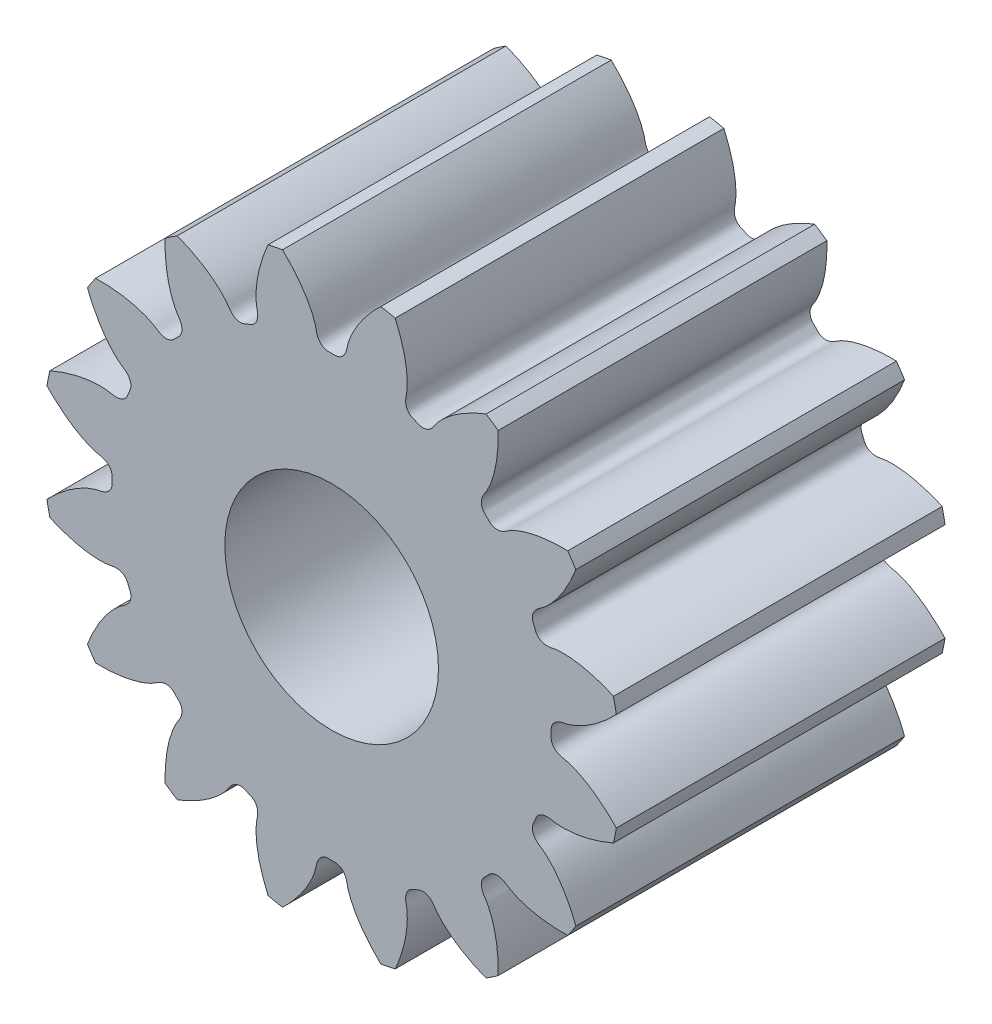
from build123d import *

# Parameters (mm, degrees)
SKETCHREVOLVESPURASSEMBLYNEW1PINION_W       = 10
SKETCHREVOLVESPURASSEMBLYNEW1PINION_H       = 8.7890625
TOOTHEXTRUDECUTSPURASSEMBLYNEW1PINION_START = -8
TOOTHEXTRUDECUTSPURASSEMBLYNEW1PINION_DEPTH = 12
PATTERNSPURASSEMBLYNEW1PINION_COUNT         = 16
SKETCH_1_R                                  = 3.25
CUT_EXTRUDE_1_DEPTH                         = 16.812131127


with BuildPart() as part:
    # SketchRevolveSpurAssemblyNew1Pinion → SpurAssemblyNew1Pinion (revolve)
    with BuildSketch(Plane(origin=(0, 0, 0), x_dir=(0, 0, -1), z_dir=(1, 0, 0))):
        with Locations((1, 4.39453125)):
            Rectangle(SKETCHREVOLVESPURASSEMBLYNEW1PINION_W, SKETCHREVOLVESPURASSEMBLYNEW1PINION_H)
    revolve(axis=Axis((0, 0, 0), (0, 0, -1)))

    # SketchToothSpurAssemblyNew1Pinion → ToothExtrudeCutSpurAssemblyNew1Pinion (cut)
    with BuildSketch(Plane.XY.offset(TOOTHEXTRUDECUTSPURASSEMBLYNEW1PINION_START)):
        with BuildLine():
            ThreePointArc((8.716029229, 1.554211503), (8.853515625, 0), (8.716029229, -1.554211503))
            add(Edge.make_bspline(
                [(8.716029229, -1.554211503), (8.62862713, -1.459312517), (8.49597106, -1.325274969), (8.314106298, -1.161849014), (8.18489776, -1.054323465), (8.059772215, -0.957996086), (7.9393825, -0.872392365), (7.82435095, -0.797004542), (7.71526784, -0.731293527), (7.612689882, -0.674690752), (7.517138975, -0.626599252), (7.429100479, -0.586397842), (7.349023414, -0.553435542), (7.277314902, -0.527057087), (7.214352885, -0.506532288), (7.160443959, -0.491276196), (7.097952634, -0.475750728), (7.046337113, -0.467920657), (7.004280637, -0.45783036), (6.985712313, -0.452872019), (6.967326671, -0.447394665), (6.949080273, -0.441357303), (6.930926481, -0.434695757), (6.912813897, -0.427331849), (6.894687768, -0.419165828), (6.876491766, -0.410072132), (6.858171606, -0.399892969), (6.839681201, -0.388431378), (6.82099277, -0.375443904), (6.802112664, -0.360634431), (6.783104949, -0.343651932), (6.764124314, -0.32409723), (6.745458017, -0.301546699), (6.727570244, -0.275603076), (6.711137767, -0.245982977), (6.69703376, -0.212637772), (6.686295044, -0.175893357), (6.680036417, -0.13805875), (6.677926166, -0.079083938), (6.68098156, 0), (6.677926166, 0.079083938), (6.680036417, 0.13805875), (6.686295044, 0.175893357), (6.69703376, 0.212637772), (6.711137767, 0.245982977), (6.727570244, 0.275603076), (6.745458017, 0.301546699), (6.764124314, 0.32409723), (6.783104949, 0.343651932), (6.802112664, 0.360634431), (6.82099277, 0.375443904), (6.839681201, 0.388431378), (6.858171606, 0.399892969), (6.876491766, 0.410072132), (6.894687768, 0.419165828), (6.912813897, 0.427331849), (6.930926481, 0.434695757), (6.949080273, 0.441357303), (6.967326671, 0.447394665), (6.985712313, 0.452872019), (7.004280637, 0.45783036), (7.046337113, 0.467920657), (7.097952634, 0.475750728), (7.160443959, 0.491276196), (7.214352885, 0.506532288), (7.277314902, 0.527057087), (7.349023414, 0.553435542), (7.429100479, 0.586397842), (7.517138975, 0.626599252), (7.612689882, 0.674690752), (7.71526784, 0.731293527), (7.82435095, 0.797004542), (7.9393825, 0.872392365), (8.059772215, 0.957996086), (8.18489776, 1.054323465), (8.314106298, 1.161849014), (8.49597106, 1.325274969), (8.62862713, 1.459312517), (8.716029229, 1.554211503)],
                knots=[0, 0, 0, 0, 0.071940146, 0.105070476, 0.136307645, 0.165651652, 0.193102497, 0.218660181, 0.242324703, 0.264096063, 0.283974262, 0.301959299, 0.318051175, 0.332249889, 0.344555442, 0.354967833, 0.363487062, 0.380444448, 0.384031118, 0.387599323, 0.39116026, 0.394726966, 0.398314667, 0.401941182, 0.405627388, 0.409397748, 0.413280862, 0.417309997, 0.421523496, 0.425964841, 0.430682071, 0.43572602, 0.44114668, 0.446986911, 0.453273001, 0.460002642, 0.467132884, 0.474573007, 0.481318675, 0.5, 0.518681325, 0.525426993, 0.532867116, 0.539997358, 0.546726999, 0.553013089, 0.55885332, 0.56427398, 0.569317929, 0.574035159, 0.578476504, 0.582690003, 0.586719138, 0.590602252, 0.594372612, 0.598058818, 0.601685333, 0.605273034, 0.60883974, 0.612400677, 0.615968882, 0.619555552, 0.636512938, 0.645032167, 0.655444558, 0.667750111, 0.681948825, 0.698040701, 0.716025738, 0.735903937, 0.757675297, 0.781339819, 0.806897503, 0.834348348, 0.863692355, 0.894929524, 0.928059854, 1, 1, 1, 1], degree=3))
        make_face()
    toothextrudecutspurassemblynew1pinion = extrude(amount=TOOTHEXTRUDECUTSPURASSEMBLYNEW1PINION_DEPTH, mode=Mode.SUBTRACT)

    # PatternSpurAssemblyNew1Pinion: ToothExtrudeCutSpurAssemblyNew1Pinion ×16 about axis
    patternspurassemblynew1pinion_axis = Axis((0, 0, 50), (0, 0, -1))
    for i in range(1, PATTERNSPURASSEMBLYNEW1PINION_COUNT):
        add(toothextrudecutspurassemblynew1pinion.rotate(patternspurassemblynew1pinion_axis, i * 360 / PATTERNSPURASSEMBLYNEW1PINION_COUNT), mode=Mode.SUBTRACT)

    # Эскиз1 → Вырез-Вытянуть1 (cut, through all)
    with BuildSketch(Plane.XY.offset(4)):
        Circle(SKETCH_1_R)
    extrude(amount=-CUT_EXTRUDE_1_DEPTH, mode=Mode.SUBTRACT)


solid = part.part
